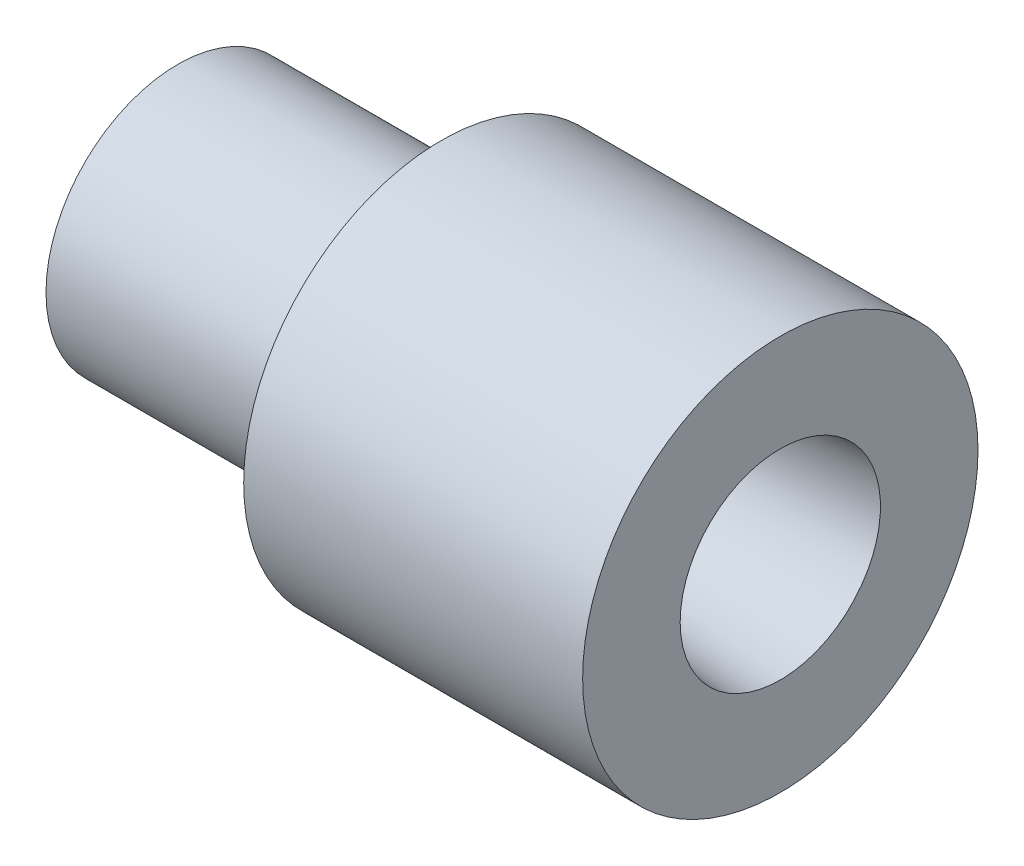
from build123d import *


with BuildPart() as part:
    # Sketch1 → Revolve1 (revolve)
    with BuildSketch(Plane(origin=(0, 0, 0), x_dir=(1, 0, 0), z_dir=(0, 1, 0)), mode=Mode.PRIVATE) as revolve1_sk:
        Polygon((0, 2.286), (0, 6.35), (12.7, 6.35), (12.7, 9.525), (29.032332849, 9.525), (29.032332849, 4.826), align=None)
    revolve(revolve1_sk.sketch.rotate(Axis((0, 0, 0), (1, 0, 0)), 180), axis=Axis((0, 0, 0), (1, 0, 0)))


solid = part.part
